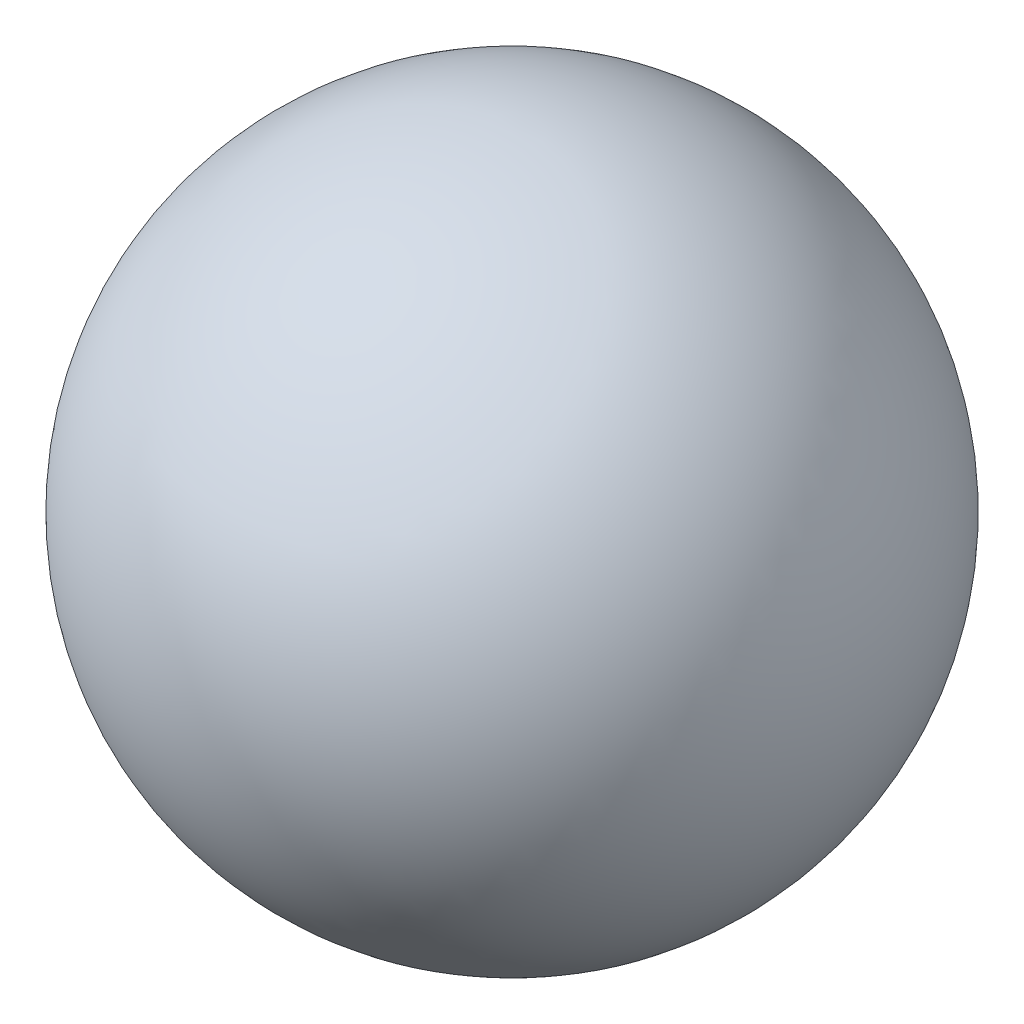
from build123d import *


with BuildPart() as part:
    # Sketch1 → Revolve1 (revolve)
    with BuildSketch(Plane.XY):
        with BuildLine():
            Line((0, 28.575), (0, -28.575))
            ThreePointArc((0, -28.575), (28.575, 0), (0, 28.575))
        make_face()
    revolve(axis=Axis((0, 28.575, 0), (0, -1, 0)))


solid = part.part
